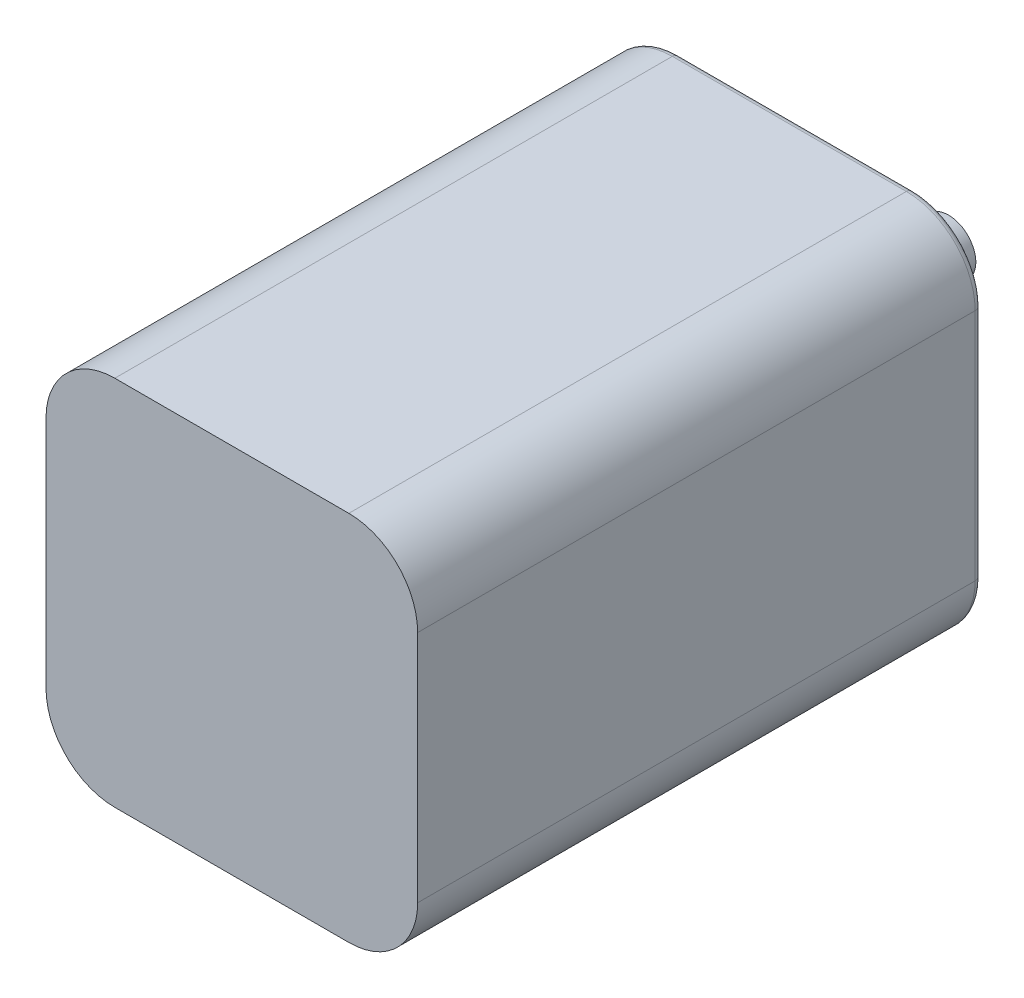
from build123d import *

# Parameters (mm, degrees)
SKETCH1_W                 = 68.58
SKETCH1_H                 = 68.58
BOSS_EXTRUDE2_DEPTH       = 104.14
SIDE_FILLETS_R            = 12.7
TOP_CUT_DEPTH             = 5.08
TOP_FACE_FILLET_R         = 1.27
SKETCH_TERMINALS_R        = 6.35
TERMINALS_DEPTH           = 15.24
TERMINALS_DRAFT           = 5
TERMINALS_PROFILE_2_DEPTH = 15.24
TERMINALS_PROFILE_2_DRAFT = 5


with BuildPart() as part:
    # Sketch1 → Boss-Extrude2 (new body)
    with BuildSketch(Plane.XY):
        Rectangle(SKETCH1_W, SKETCH1_H)
    extrude(amount=BOSS_EXTRUDE2_DEPTH)

    # Side Fillets
    side_fillets_edges = [part.edges().sort_by_distance(p)[0] for p in [
        (34.29, -34.29, 52.07),
        (-34.29, -34.29, 52.07),
        (-34.29, 34.29, 52.07),
        (34.29, 34.29, 52.07),
    ]]
    fillet(side_fillets_edges, radius=SIDE_FILLETS_R)

    # Sketch8 → Top Cut (cut)
    with BuildSketch(Plane(origin=(0, 0, 0), x_dir=(-1, 0, 0), z_dir=(0, 0, -1))):
        with BuildLine():
            Line((30.48, -21.59), (30.48, 21.59))
            ThreePointArc((30.48, 21.59), (27.876179285, 27.876179285), (21.59, 30.48))
            Line((21.59, 30.48), (-21.59, 30.48))
            ThreePointArc((-21.59, 30.48), (-27.876179285, 27.876179285), (-30.48, 21.59))
            Line((-30.48, 21.59), (-30.48, -21.59))
            ThreePointArc((-30.48, -21.59), (-27.876179285, -27.876179285), (-21.59, -30.48))
            Line((-21.59, -30.48), (21.59, -30.48))
            ThreePointArc((21.59, -30.48), (27.876179285, -27.876179285), (30.48, -21.59))
        make_face()
    extrude(amount=-TOP_CUT_DEPTH, mode=Mode.SUBTRACT)

    # Top Face Fillet
    top_face_fillet_edges = [part.edges().sort_by_distance(p)[0] for p in [
        (-34.29, 0, 0),
        (34.29, 0, 0),
        (0, -34.29, 0),
        (0, 34.29, 0),
        (-30.570256121, -30.570256121, 0),
        (30.570256121, -30.570256121, 0),
        (30.570256121, 30.570256121, 0),
        (-30.570256121, 30.570256121, 0),
        (-27.876179285, -27.876179285, 0),
        (-30.48, 0, 0),
        (-27.876179285, 27.876179285, 0),
        (0, 30.48, 0),
        (27.876179285, 27.876179285, 0),
        (30.48, 0, 0),
        (27.876179285, -27.876179285, 0),
        (0, -30.48, 0),
    ]]
    fillet(top_face_fillet_edges, radius=TOP_FACE_FILLET_R)


with BuildPart() as terminals_tool:
    # Sketch-TERMINALS → Terminals (with draft: the straight prism first)
    with BuildSketch(Plane(origin=(0, 0, 5.08), x_dir=(-1, 0, 0), z_dir=(0, 0, -1))):
        Circle(SKETCH_TERMINALS_R)
    extrude(amount=TERMINALS_DEPTH)
    # Terminals: the draft: its side faces are tilted about the plane it starts from
    terminals_sides = [terminals_tool.faces().sort_by_distance(p)[0] for p in [
        (6.35, 0, -2.54),
    ]]
    draft(terminals_sides, Plane(origin=(0, 0, 5.08), x_dir=(-1, 0, 0), z_dir=(0, 0, -1)), TERMINALS_DRAFT)


with BuildPart() as part_1:
    add(part.part)

    # Terminals: add terminals_tool
    add(terminals_tool.part)


with BuildPart() as terminals_profile_2_tool:
    # Sketch-TERMINALS → Terminals profile 2 (with draft: the straight prism first)
    with BuildSketch(Plane(origin=(0, 0, 5.08), x_dir=(-1, 0, 0), z_dir=(0, 0, -1))):
        with Locations((-17.960512242, 17.960512242)):
            Circle(SKETCH_TERMINALS_R)
    extrude(amount=TERMINALS_PROFILE_2_DEPTH)
    # Terminals profile 2: the draft: its side faces are tilted about the plane it starts from
    terminals_profile_2_sides = [terminals_profile_2_tool.faces().sort_by_distance(p)[0] for p in [
        (24.310512242, 17.960512242, -2.54),
    ]]
    draft(terminals_profile_2_sides, Plane(origin=(0, 0, 5.08), x_dir=(-1, 0, 0), z_dir=(0, 0, -1)), TERMINALS_PROFILE_2_DRAFT)


with BuildPart() as part_2:
    add(part_1.part)

    # Terminals profile 2: add terminals_profile_2_tool
    add(terminals_profile_2_tool.part)


solid = part_2.part
